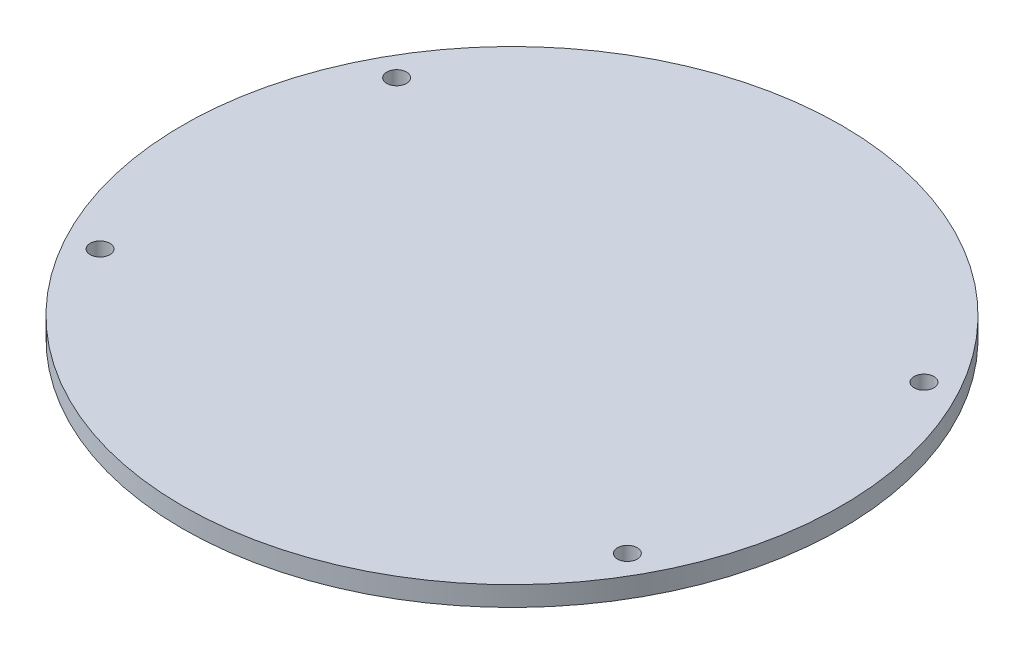
from build123d import *

# Parameters (mm, degrees)
SKETCH1_R           = 50
SKETCH1_R_2         = 1.5
BOSS_EXTRUDE1_DEPTH = 3


with BuildPart() as part:
    # Sketch1 → Boss-Extrude1 (new body)
    with BuildSketch(Plane(origin=(0, 0, 0), x_dir=(1, 0, 0), z_dir=(0, 1, 0))):
        with Locations(Location((0, 0, 0), (0, 0, 270))):
            Circle(SKETCH1_R)
        with Locations(Location((-40, 22.5, 0), (0, 0, 270))):
            Circle(SKETCH1_R_2, mode=Mode.SUBTRACT)
        with Locations(Location((40, 22.5, 0), (0, 0, 270))):
            Circle(SKETCH1_R_2, mode=Mode.SUBTRACT)
        with Locations(Location((40, -22.5, 0), (0, 0, 270))):
            Circle(SKETCH1_R_2, mode=Mode.SUBTRACT)
        with Locations(Location((-40, -22.5, 0), (0, 0, 270))):
            Circle(SKETCH1_R_2, mode=Mode.SUBTRACT)
    extrude(amount=BOSS_EXTRUDE1_DEPTH)


solid = part.part
